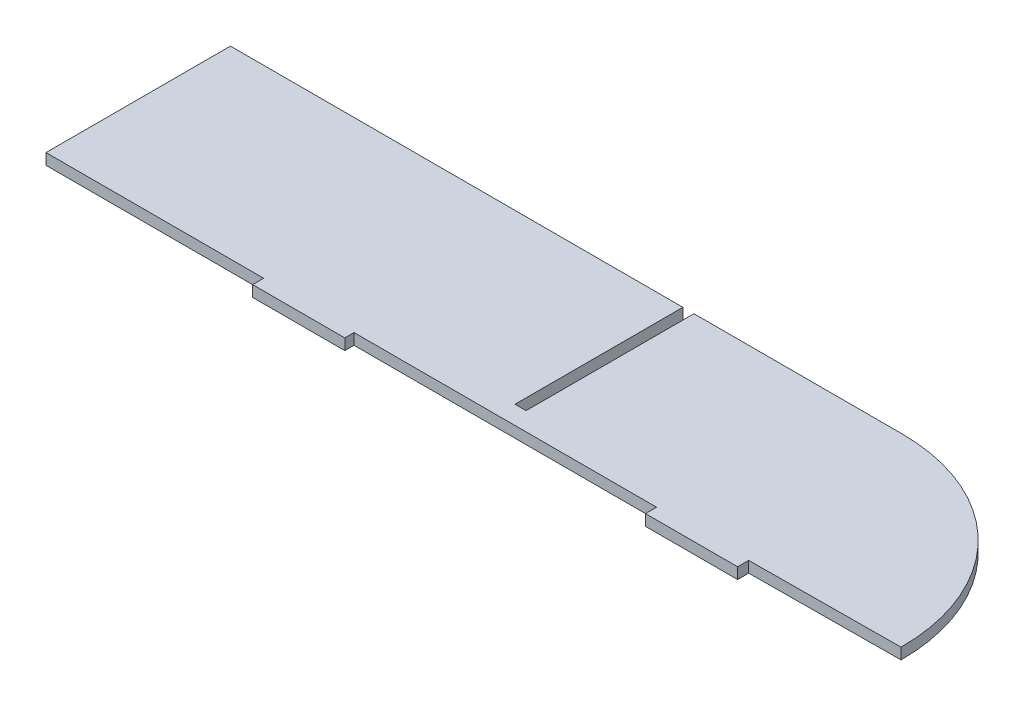
from build123d import *

# Parameters (mm, degrees)
BOSS_EXTRUDE1_DEPTH = 6


with BuildPart() as part:
    # Sketch1 → Boss-Extrude1 (new body)
    with BuildSketch(Plane(origin=(0, 0, 0), x_dir=(1, 0, 0), z_dir=(0, 1, 0))):
        with BuildLine():
            Line((-232, -140.040234189), (13.316058598, -140.040234189))
            Line((13.316058598, -140.040234189), (13.316058598, -231.040234189))
            Line((13.316058598, -231.040234189), (19.316058598, -231.040234189))
            Line((19.316058598, -231.040234189), (19.316058598, -140.040234189))
            Line((19.316058598, -140.040234189), (132, -140.040234189))
            ThreePointArc((132, -140.040234189), (202.864098928, -169.483310481), (231.999056434, -240.474644527))
            Line((231.999056434, -240.474644527), (149.958626336, -241.040376839))
            Line((149.958626336, -241.040376839), (150, -247.040234189))
            Line((150, -247.040234189), (100, -247.040234189))
            Line((100, -247.040234189), (100, -241.040234189))
            Line((100, -241.040234189), (-64, -241.040234189))
            Line((-64, -241.040234189), (-64, -246.040234189))
            Line((-64, -246.040234189), (-114, -246.040234189))
            Line((-114, -246.040234189), (-114, -240.040234189))
            Line((-114, -240.040234189), (-232, -240.040234189))
            Line((-232, -240.040234189), (-232, -140.040234189))
        make_face()
    extrude(amount=BOSS_EXTRUDE1_DEPTH)


solid = part.part
